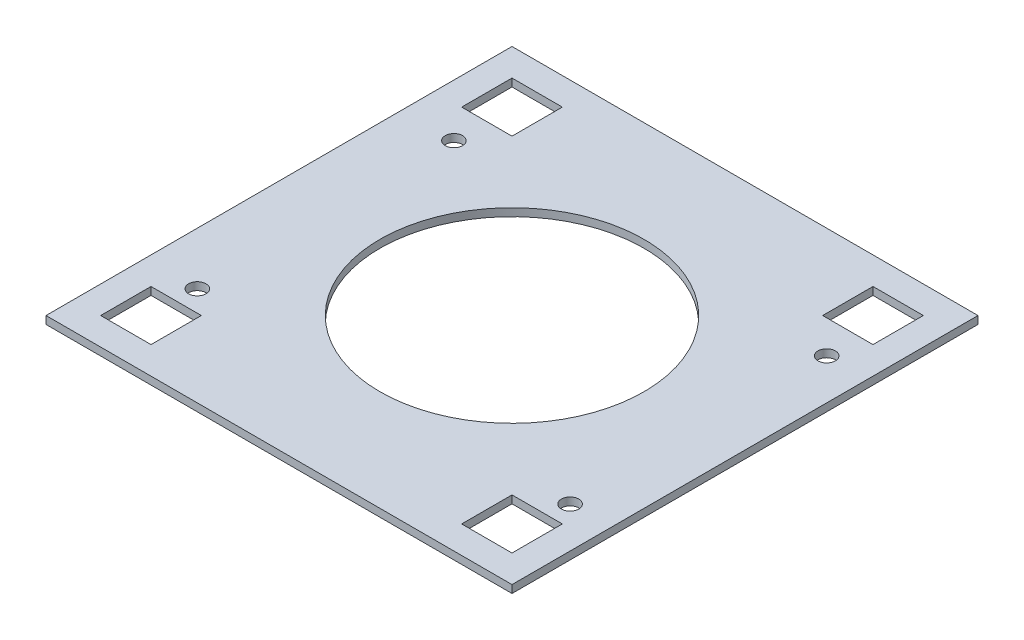
from build123d import *

# Parameters (mm, degrees)
SKETCH1_W           = 381
SKETCH1_H           = 381
BOSS_EXTRUDE1_DEPTH = 6.35
SKETCH2_R           = 107.95
CUT_EXTRUDE1_DEPTH  = 6.35
SKETCH3_W           = 41.148
SKETCH3_H           = 41.148
CUT_EXTRUDE2_DEPTH  = 6.35
SKETCH3_4_R         = 7.112
CUT_EXTRUDE3_DEPTH  = 270.482508709


with BuildPart() as part:
    # Sketch1 → Boss-Extrude1 (new body)
    with BuildSketch(Plane(origin=(0, 0, 0), x_dir=(1, 0, 0), z_dir=(0, 1, 0))):
        Rectangle(SKETCH1_W, SKETCH1_H)
    extrude(amount=BOSS_EXTRUDE1_DEPTH)

    # Sketch2 → Cut-Extrude1 (cut)
    with BuildSketch(Plane(origin=(0, 6.35, 0), x_dir=(1, 0, 0), z_dir=(0, 1, 0))):
        Circle(SKETCH2_R)
    extrude(amount=-CUT_EXTRUDE1_DEPTH, mode=Mode.SUBTRACT)

    # Sketch3 → Cut-Extrude2 (cut)
    with BuildSketch(Plane(origin=(0, 6.35, 0), x_dir=(1, 0, 0), z_dir=(0, 1, 0))):
        with Locations((147.574, 147.574)):
            Rectangle(SKETCH3_W, SKETCH3_H)
        with Locations((-147.574, 147.574)):
            Rectangle(SKETCH3_W, SKETCH3_H)
        with Locations((147.574, -147.574)):
            Rectangle(SKETCH3_W, SKETCH3_H)
        with Locations((-147.574, -147.574)):
            Rectangle(SKETCH3_W, SKETCH3_H)
    extrude(amount=-CUT_EXTRUDE2_DEPTH, mode=Mode.SUBTRACT)

    # Sketch3<4> → Cut-Extrude3 (cut, through all)
    with BuildSketch(Plane(origin=(0, 6.35, 0), x_dir=(1, 0, 0), z_dir=(0, 1, 0))):
        with Locations((-147.574, 100.076)):
            Circle(SKETCH3_4_R)
        with Locations((157.226, 100.076)):
            Circle(SKETCH3_4_R)
        with Locations((157.226, -109.728)):
            Circle(SKETCH3_4_R)
        with Locations((-147.574, -109.728)):
            Circle(SKETCH3_4_R)
    extrude(amount=-CUT_EXTRUDE3_DEPTH, mode=Mode.SUBTRACT)


solid = part.part
